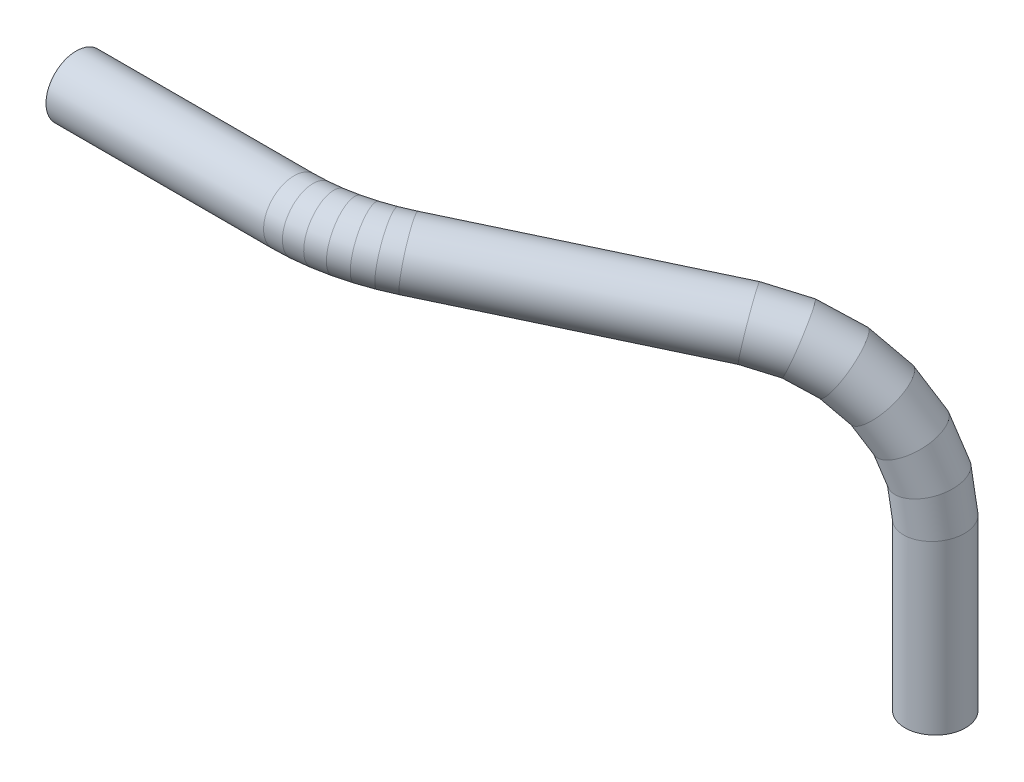
from build123d import *

# Parameters (mm, degrees)
PROFILE_R   = 4.7625
PROFILE_R_2 = 3.8735


with BuildPart() as part:
    # Tube: sweep along a curve in space
    with BuildLine() as tube_path:
        Line((28.2, 105.245573528, 38.306256052), (62.341451663, 105.245573528, 38.306256052))
        Line((62.341451663, 105.245573528, 38.306256052), (64.808223176, 105.218825972, 38.181995595))
        Line((64.808223176, 105.218825972, 38.181995595), (67.248866106, 105.138866619, 37.810530418))
        Line((67.248866106, 105.138866619, 37.810530418), (69.63752863, 105.006542417, 37.195795159))
        Line((69.63752863, 105.006542417, 37.195795159), (71.948909514, 104.823254972, 36.344301231))
        Line((71.948909514, 104.823254972, 36.344301231), (74.158526106, 104.590945705, 35.265067843))
        Line((74.158526106, 104.590945705, 35.265067843), (76.242973665, 104.312075287, 33.969526469))
        Line((76.242973665, 104.312075287, 33.969526469), (107.835723721, 99.58808025, 12.023380107))
        Line((107.835723721, 99.58808025, 12.023380107), (112.443681745, 98.197740878, 8.82242669))
        Line((112.443681745, 98.197740878, 8.82242669), (116.644976055, 95.506248168, 5.903965345))
        Line((116.644976055, 95.506248168, 5.903965345), (120.195899313, 91.669729365, 3.437289243))
        Line((120.195899313, 91.669729365, 3.437289243), (122.890470703, 86.910732024, 1.565484541))
        Line((122.890470703, 86.910732024, 1.565484541), (124.572384389, 81.505314539, 0.397130287))
        Line((124.572384389, 81.505314539, 0.397130287), (125.144076461, 75.767032634, 0))
        Line((125.144076461, 75.767032634, 0), (125.144076461, 49.4, 0))
    # Profile → Tube (sweep)
    with BuildSketch(Plane(origin=(28.2, 0, 0), x_dir=(0, 0, -1), z_dir=(1, 0, 0))):
        with Locations((-38.306256052, 105.245573528)):
            Circle(PROFILE_R)
        with Locations((-38.306256052, 105.245573528)):
            Circle(PROFILE_R_2, mode=Mode.SUBTRACT)
    sweep(path=tube_path.line, transition=Transition.RIGHT)


solid = part.part
